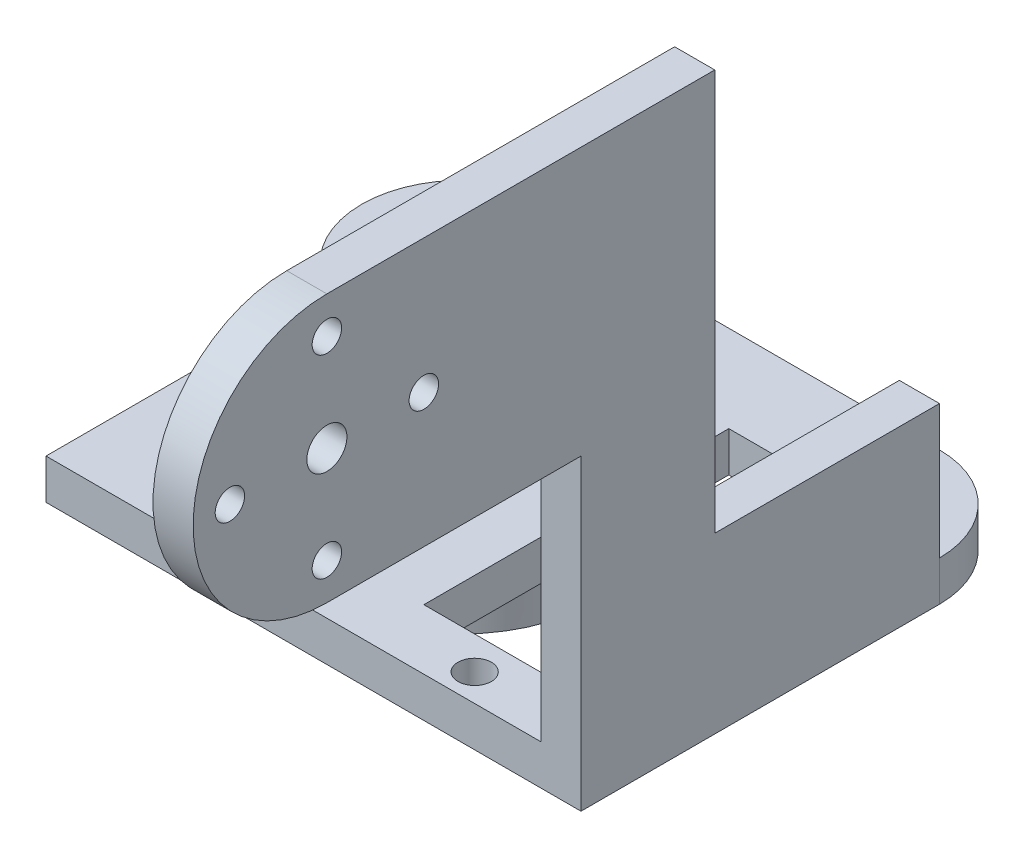
from build123d import *

# Parameters (mm, degrees)
SKETCH_1_R      = 4.5
SKETCH_1_R_2    = 1.25
SKETCH_1_W      = 12.5
SKETCH_1_H      = 22.8
EXTRUDE_1_DEPTH = 3
EXTRUDE_START   = 20
SKETCH_3_R      = 1.1
SKETCH_3_R_2    = 1.5
EXTRUDE_2_DEPTH = 3
SKETCH_4_R      = 7.5
SKETCH_4_R_2    = 4.5
EXTRUDE_3_DEPTH = 7
EXTRUDE_START_2 = 7
SKETCH_5_R      = 10
SKETCH_5_R_2    = 7.5
EXTRUDE_4_DEPTH = 7


with BuildPart() as part:
    # 草图1 → 凸台-拉伸1 (new body)
    with BuildSketch(Plane(origin=(0, 0, 0), x_dir=(1, 0, 0), z_dir=(0, 1, 0))):
        with BuildLine():
            Line((-20, -15.9), (20, -15.9))
            Line((20, -15.9), (20, 10.9))
            ThreePointArc((20, 10.9), (17.949747468, 15.849747468), (13, 17.9))
            Line((13, 17.9), (-13, 17.9))
            ThreePointArc((-13, 17.9), (-17.949747468, 15.849747468), (-20, 10.9))
            Line((-20, 10.9), (-20, -15.9))
        make_face()
        with Locations(Location((-10, 5.2, 0), (0, 0, 270))):
            Circle(SKETCH_1_R, mode=Mode.SUBTRACT)
        with Locations(Location((10, 13.85, 0), (0, 0, 270))):
            Circle(SKETCH_1_R_2, mode=Mode.SUBTRACT)
        with Locations(Location((10, -13.85, 0), (0, 0, 270))):
            Circle(SKETCH_1_R_2, mode=Mode.SUBTRACT)
        with Locations((10, 0)):
            Rectangle(SKETCH_1_W, SKETCH_1_H, mode=Mode.SUBTRACT)
    extrude(amount=EXTRUDE_1_DEPTH)

    # 草图3 → 凸台-拉伸2 (add)
    with BuildSketch(Plane(origin=(0, 0, 0), x_dir=(0, 0, -1), z_dir=(1, 0, 0)).offset(EXTRUDE_START)):
        with BuildLine():
            Line((-15.9, 3), (-15.9, 23))
            Line((-15.9, 23), (-34.9, 23))
            ThreePointArc((-34.9, 23), (-44.9, 33), (-34.9, 43))
            Line((-34.9, 43), (-5.9, 43))
            Line((-5.9, 43), (-5.9, 13))
            Line((-5.9, 13), (10.9, 13))
            Line((10.9, 13), (10.9, 3))
            Line((10.9, 3), (-15.9, 3))
        make_face()
        with Locations(Location((-42.15, 33, 0), (0, 0, 180))):
            Circle(SKETCH_3_R, mode=Mode.SUBTRACT)
        with Locations(Location((-34.9, 40.25, 0), (0, 0, 180))):
            Circle(SKETCH_3_R, mode=Mode.SUBTRACT)
        with Locations(Location((-27.65, 33, 0), (0, 0, 180))):
            Circle(SKETCH_3_R, mode=Mode.SUBTRACT)
        with Locations(Location((-34.9, 25.75, 0), (0, 0, 180))):
            Circle(SKETCH_3_R, mode=Mode.SUBTRACT)
        with Locations(Location((-34.9, 33, 0), (0, 0, 180))):
            Circle(SKETCH_3_R_2, mode=Mode.SUBTRACT)
    extrude(amount=-EXTRUDE_2_DEPTH)

    # 草图4 → 凸台-拉伸3 (add)
    with BuildSketch(Plane(origin=(0, 3, 0), x_dir=(1, 0, 0), z_dir=(0, 1, 0))):
        with Locations(Location((-10, 5.2, 0), (0, 0, 90))):
            Circle(SKETCH_4_R)
        with Locations(Location((-10, 5.2, 0), (0, 0, 270))):
            Circle(SKETCH_4_R_2, mode=Mode.SUBTRACT)
    extrude(amount=EXTRUDE_3_DEPTH)

    # 草图5 → 凸台-拉伸4 (add)
    with BuildSketch(Plane.XZ.offset(EXTRUDE_START_2)):
        with Locations(Location((-10, -5.2, 0), (0, 0, 180))):
            Circle(SKETCH_5_R)
        with Locations(Location((-10, -5.2, 0), (0, 0, 270))):
            Circle(SKETCH_5_R_2, mode=Mode.SUBTRACT)
    extrude(amount=-EXTRUDE_4_DEPTH)


solid = part.part
